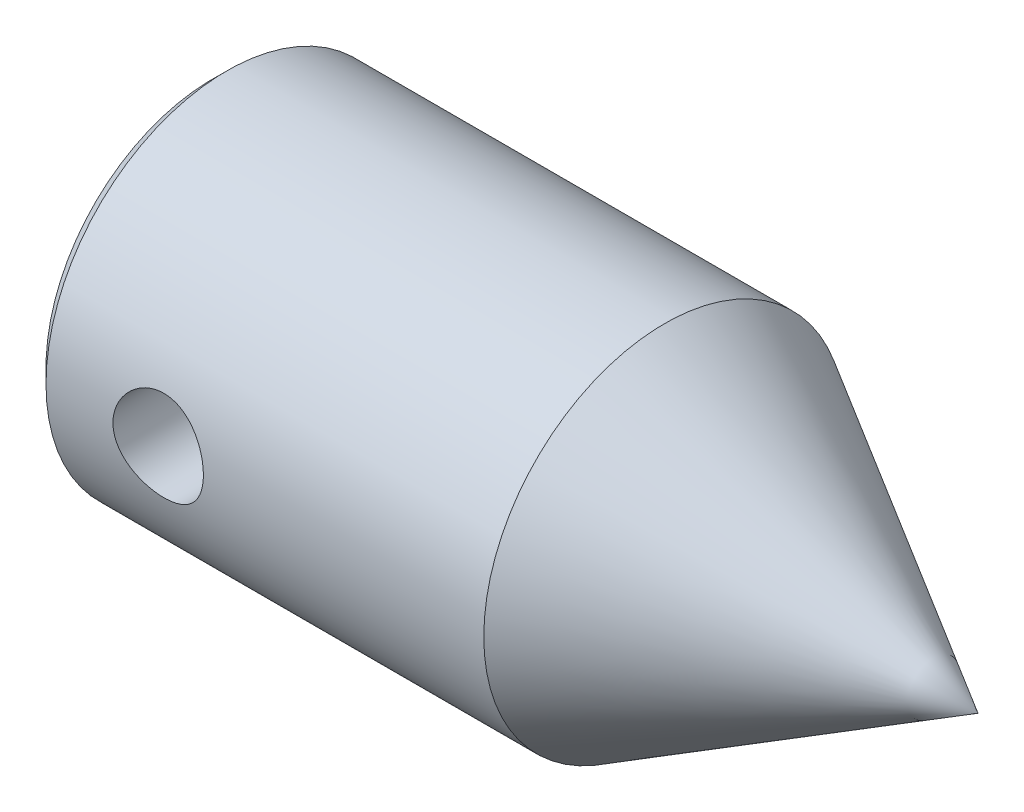
from build123d import *

# Parameters (mm, degrees)
SKETCH2_R          = 3.175
CUT_EXTRUDE1_DEPTH = 57.668552776
CHAMFER1_SIZE      = 1.016


with BuildPart() as part:
    # Sketch1 → Revolve1 (revolve)
    with BuildSketch(Plane.XY, mode=Mode.PRIVATE) as revolve1_sk:
        Polygon((0, 12.7), (31.75, 12.7), (53.747045256, 0), (33.3375, 0), (25.4, 7.9375), (0, 7.9375), align=None)
    revolve(revolve1_sk.sketch.rotate(Axis((0, 0, 0), (1, 0, 0)), 90), axis=Axis((0, 0, 0), (1, 0, 0)))

    # Sketch2 → Cut-Extrude1 (cut, through all)
    with BuildSketch(Plane.XY):
        with Locations(Location((8.89, 0, 0), (0, 0, 180))):
            Circle(SKETCH2_R)
    extrude(amount=CUT_EXTRUDE1_DEPTH, mode=Mode.SUBTRACT)

    # Chamfer1
    chamfer1_edges = [part.edges().sort_by_distance(p)[0] for p in [
        (0, 0, -12.7),
        (0, 0, -7.9375),
    ]]
    chamfer(chamfer1_edges, length=CHAMFER1_SIZE)


solid = part.part
